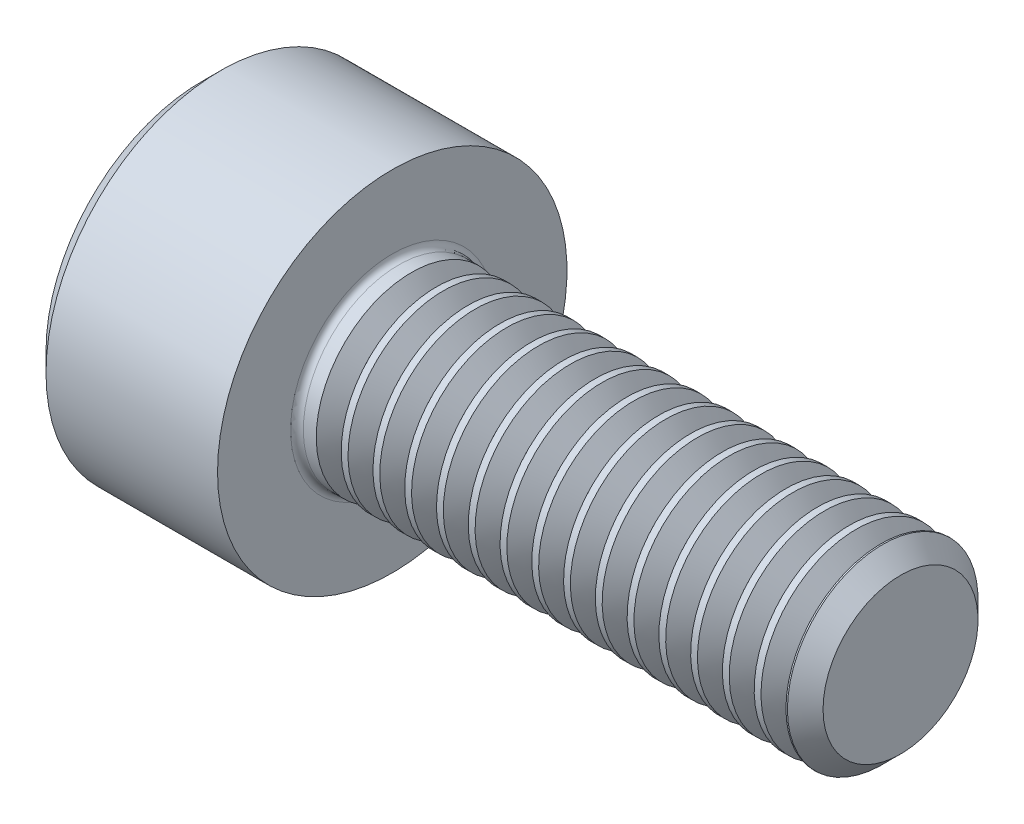
from build123d import *

# Parameters (mm, degrees)
FILLET1_R       = 0.1
HEX_2_DEPTH     = 1.3
THDSCHPAT_COUNT = 15
THDSCHPAT_PITCH = 0.5


with BuildPart() as part:
    # BodySke → Base-Revolve (revolve)
    with BuildSketch(Plane.XY, mode=Mode.PRIVATE) as base_revolve_sk:
        Polygon((0, 0), (0, 2.45), (0.3, 2.75), (3, 2.75), (3, 1.5), (10.7195, 1.5), (11, 1.2195), (11, 0), align=None)
    revolve(base_revolve_sk.sketch.rotate(Axis((-31.75, 0, 0), (1, 0, 0)), 90), axis=Axis((-31.75, 0, 0), (1, 0, 0)))

    # Fillet1
    fillet1_edges = [part.edges().sort_by_distance(p)[0] for p in [
        (3, 0, -1.5),
    ]]
    fillet(fillet1_edges, radius=FILLET1_R)

    # Sketch2 → Hex-PreBroach (revolve, cut)
    with BuildSketch(Plane.XY, mode=Mode.PRIVATE) as hex_prebroach_sk:
        Polygon((0, 1.28), (1.3, 1.28), (2.039008345, 0), (0, 0), align=None)
    revolve(hex_prebroach_sk.sketch.rotate(Axis((0, 0, 0), (1, 0, 0)), 90), axis=Axis((0, 0, 0), (1, 0, 0)), mode=Mode.SUBTRACT)

    # Sketch3 → Hex 2 (cut)
    with BuildSketch(Plane(origin=(0, 0, 0), x_dir=(0, 0.500000000000001, 0.866025403784438), z_dir=(-1, 0, 0))):
        Polygon((0.739008345, 1.28), (-0.739008345, 1.28), (-1.478016689, 0), (-0.739008345, -1.28), (0.739008345, -1.28), (1.478016689, 0), align=None)
    extrude(amount=-HEX_2_DEPTH, mode=Mode.SUBTRACT)

    # ThdSchSke → ThreadSchematic (revolve, cut)
    with BuildSketch(Plane.XY):
        Polygon((3.5, -1.2195), (3.303591786, -1.5), (3.303591786, -1.875), (3.696408214, -1.875), (3.696408214, -1.5), align=None)
    threadschematic = revolve(axis=Axis((-3.175, 0, 0), (1, 0, 0)), mode=Mode.SUBTRACT)

    # ThdSchPat: ThreadSchematic ×15
    with Locations(*[(i * THDSCHPAT_PITCH, 0, 0) for i in range(1, THDSCHPAT_COUNT)]):
        add(threadschematic, mode=Mode.SUBTRACT)


solid = part.part
